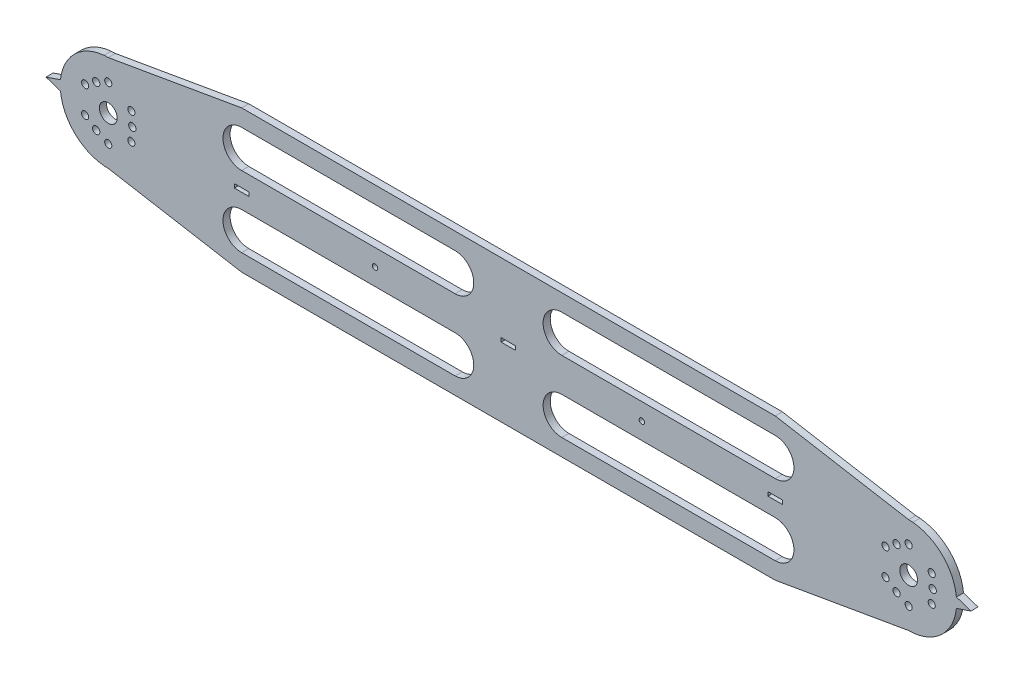
from build123d import *

# Parameters (mm, degrees)
SKETCH_1_R      = 2
SKETCH_1_R_2    = 2.05
SKETCH_1_R_3    = 5
SKETCH_1_R_4    = 1.5
SKETCH_1_W      = 8.2
SKETCH_1_H      = 2.2
EXTRUDE_1_DEPTH = 4


with BuildPart() as part:
    # 草图1 → 凸台-拉伸1 (new body)
    with BuildSketch(Plane.XY):
        with BuildLine():
            Line((375, 40), (450, 27))
            Line((450, 27), (452.35435733, 26.897156013))
            ThreePointArc((452.35435733, 26.897156013), (468.941976287, 19.240621984), (476.857038268, 2.774796472))
            Line((476.857038268, 2.774796472), (485, 0))
            Line((485, 0), (476.857038268, -2.774796472))
            ThreePointArc((476.857038268, -2.774796472), (468.941976287, -19.240621984), (452.35435733, -26.897156013))
            Line((452.35435733, -26.897156013), (450, -27))
            Line((450, -27), (375, -40))
            Line((375, -40), (75, -40))
            Line((75, -40), (0, -27))
            Line((0, -27), (-2.35435733, -26.897156013))
            ThreePointArc((-2.35435733, -26.897156013), (-18.941976287, -19.240621984), (-26.857038268, -2.774796472))
            Line((-26.857038268, -2.774796472), (-35, 0))
            Line((-35, 0), (-26.857038268, 2.774796472))
            ThreePointArc((-26.857038268, 2.774796472), (-18.941976287, 19.240621984), (-2.35435733, 26.897156013))
            Line((-2.35435733, 26.897156013), (0, 27))
            Line((0, 27), (75, 40))
            Line((75, 40), (375, 40))
        make_face()
        with Locations((0, -15)):
            Circle(SKETCH_1_R, mode=Mode.SUBTRACT)
        with Locations((-12.990381057, -7.5)):
            Circle(SKETCH_1_R, mode=Mode.SUBTRACT)
        with Locations((-12.990381057, 7.5)):
            Circle(SKETCH_1_R, mode=Mode.SUBTRACT)
        with Locations((0, 15)):
            Circle(SKETCH_1_R, mode=Mode.SUBTRACT)
        with Locations((12.990381057, 7.5)):
            Circle(SKETCH_1_R, mode=Mode.SUBTRACT)
        with Locations((12.990381057, -7.5)):
            Circle(SKETCH_1_R, mode=Mode.SUBTRACT)
        with Locations((13.53, 0)):
            Circle(SKETCH_1_R_2, mode=Mode.SUBTRACT)
        with Locations((-6.765, -11.717323713)):
            Circle(SKETCH_1_R_2, mode=Mode.SUBTRACT)
        with Locations((-6.765, 11.717323713)):
            Circle(SKETCH_1_R_2, mode=Mode.SUBTRACT)
        Circle(SKETCH_1_R_3, mode=Mode.SUBTRACT)
        with Locations((450, -15)):
            Circle(SKETCH_1_R, mode=Mode.SUBTRACT)
        with Locations((437.009618943, -7.5)):
            Circle(SKETCH_1_R, mode=Mode.SUBTRACT)
        with Locations((437.009618943, 7.5)):
            Circle(SKETCH_1_R, mode=Mode.SUBTRACT)
        with Locations((450, 15)):
            Circle(SKETCH_1_R, mode=Mode.SUBTRACT)
        with Locations((462.990381057, 7.5)):
            Circle(SKETCH_1_R, mode=Mode.SUBTRACT)
        with Locations((462.990381057, -7.5)):
            Circle(SKETCH_1_R, mode=Mode.SUBTRACT)
        with Locations((463.53, 0)):
            Circle(SKETCH_1_R_2, mode=Mode.SUBTRACT)
        with Locations((443.235, -11.717323713)):
            Circle(SKETCH_1_R_2, mode=Mode.SUBTRACT)
        with Locations((443.235, 11.717323713)):
            Circle(SKETCH_1_R_2, mode=Mode.SUBTRACT)
        with Locations((450, 0)):
            Circle(SKETCH_1_R_3, mode=Mode.SUBTRACT)
        with Locations((300, 0)):
            Circle(SKETCH_1_R_4, mode=Mode.SUBTRACT)
        with Locations((150, 0)):
            Circle(SKETCH_1_R_4, mode=Mode.SUBTRACT)
        with Locations((225, 0)):
            Rectangle(SKETCH_1_W, SKETCH_1_H, mode=Mode.SUBTRACT)
        with Locations((75, 0)):
            Rectangle(SKETCH_1_W, SKETCH_1_H, mode=Mode.SUBTRACT)
        with Locations((375, 0)):
            Rectangle(SKETCH_1_W, SKETCH_1_H, mode=Mode.SUBTRACT)
        with BuildLine():
            Line((75, 30.5), (195, 30.5))
            ThreePointArc((195, 30.5), (205.5, 20), (195, 9.5))
            Line((195, 9.5), (75, 9.5))
            ThreePointArc((75, 9.5), (64.5, 20), (75, 30.5))
        make_face(mode=Mode.SUBTRACT)
        with BuildLine():
            Line((375, 30.5), (255, 30.5))
            ThreePointArc((255, 30.5), (244.5, 20), (255, 9.5))
            Line((255, 9.5), (375, 9.5))
            ThreePointArc((375, 9.5), (385.5, 20), (375, 30.5))
        make_face(mode=Mode.SUBTRACT)
        with BuildLine():
            Line((75, -30.5), (195, -30.5))
            ThreePointArc((195, -30.5), (205.5, -20), (195, -9.5))
            Line((195, -9.5), (75, -9.5))
            ThreePointArc((75, -9.5), (64.5, -20), (75, -30.5))
        make_face(mode=Mode.SUBTRACT)
        with BuildLine():
            Line((375, -30.5), (255, -30.5))
            ThreePointArc((255, -30.5), (244.5, -20), (255, -9.5))
            Line((255, -9.5), (375, -9.5))
            ThreePointArc((375, -9.5), (385.5, -20), (375, -30.5))
        make_face(mode=Mode.SUBTRACT)
    extrude(amount=EXTRUDE_1_DEPTH)


solid = part.part
